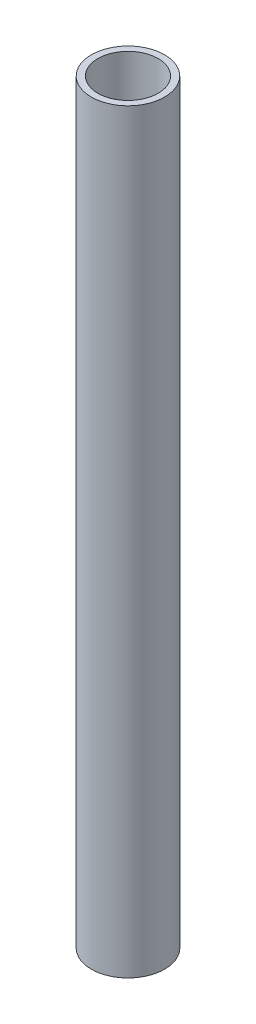
from build123d import *

# Parameters (mm, degrees)
SKETCH1_R           = 9.652
SKETCH1_R_2         = 7.9375
BOSS_EXTRUDE1_DEPTH = 199


with BuildPart() as part:
    # Sketch1 → Boss-Extrude1 (new body)
    with BuildSketch(Plane(origin=(0, 0, 0), x_dir=(1, 0, 0), z_dir=(0, 1, 0))):
        with Locations(Location((0, 0, 0), (0, 0, 270))):
            Circle(SKETCH1_R)
        with Locations(Location((0, 0, 0), (0, 0, 270))):
            Circle(SKETCH1_R_2, mode=Mode.SUBTRACT)
    extrude(amount=BOSS_EXTRUDE1_DEPTH)


solid = part.part
